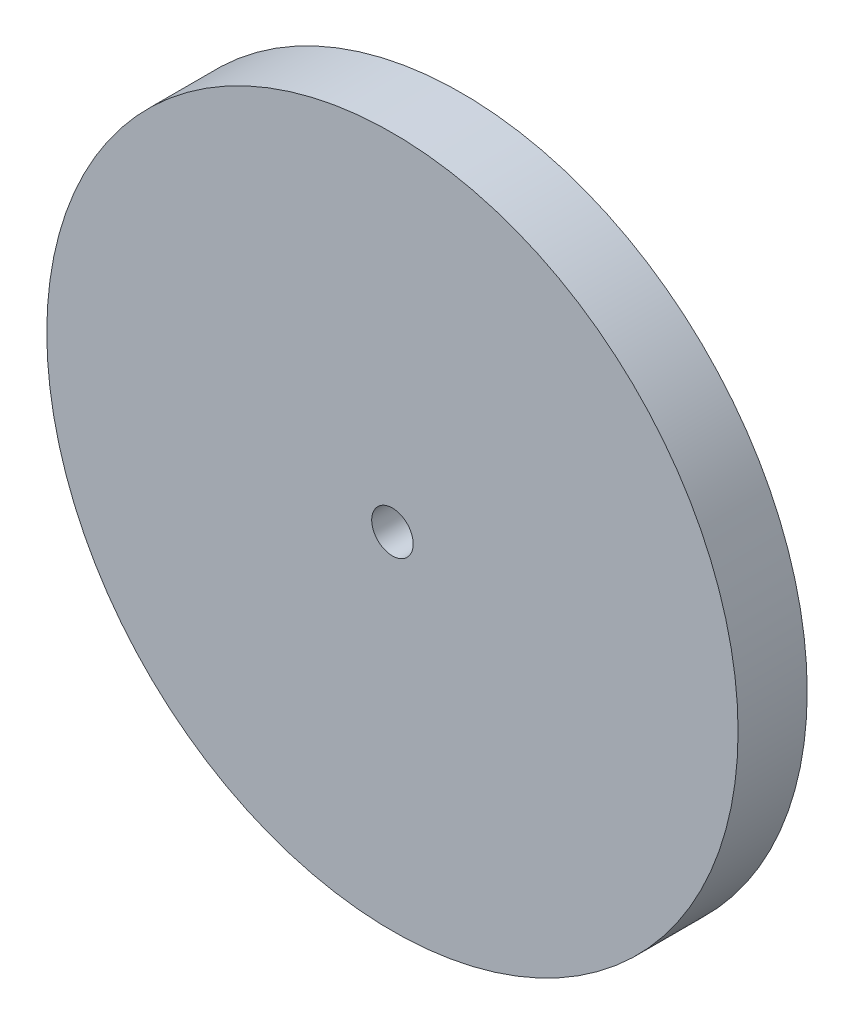
from build123d import *

# Parameters (mm, degrees)
SKETCH1_R           = 50
SKETCH1_R_2         = 3
BOSS_EXTRUDE2_DEPTH = 10


with BuildPart() as part:
    # Sketch1 → Boss-Extrude2 (new body)
    with BuildSketch(Plane.XY):
        Circle(SKETCH1_R)
        Circle(SKETCH1_R_2, mode=Mode.SUBTRACT)
    extrude(amount=BOSS_EXTRUDE2_DEPTH)


solid = part.part
